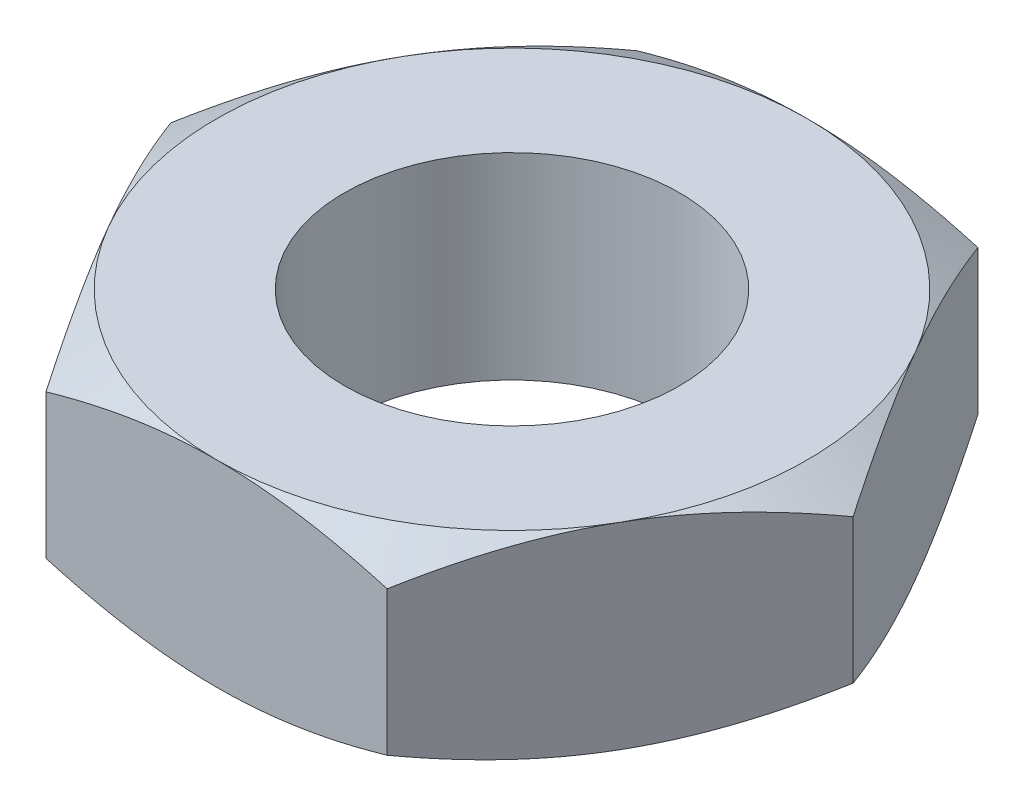
from build123d import *

# Parameters (mm, degrees)
BOSS_EXTRUDE1_DEPTH     = 3
M12X1_75_TAPPED_HOLE1_D = 10.2


with BuildPart() as part:
    # Sketch1 → Boss-Extrude1 (new, symmetric)
    with BuildSketch(Plane(origin=(0, 0, 0), x_dir=(1, 0, 0), z_dir=(0, 1, 0))):
        Polygon((10.392304845, 0), (5.196152423, 9), (-5.196152423, 9), (-10.392304845, 0), (-5.196152423, -9), (5.196152423, -9), align=None)
    extrude(amount=BOSS_EXTRUDE1_DEPTH, both=True)

    # Sketch2 → Cut-Revolve1 (revolve, cut)
    with BuildSketch(Plane(origin=(0, 0, 0), x_dir=(0, 0, -1), z_dir=(1, 0, 0))):
        Polygon((9, 3), (13.81357482, 3), (13.81357482, 0.220881282), align=None)
    cut_revolve1 = revolve(axis=Axis((0, 0, 0), (0, -1, 0)), mode=Mode.SUBTRACT)

    # Mirror1: Cut-Revolve1 across plane
    add(cut_revolve1.mirror(Plane.ZX), mode=Mode.SUBTRACT)

    # M12x1.75 Tapped Hole1 (through all)
    with Locations(Plane(origin=(0, 3, 0), x_dir=(1, 0, 0), z_dir=(0, 1, 0))):
        with Locations((0, 0)):
            Hole(M12X1_75_TAPPED_HOLE1_D / 2)


solid = part.part
